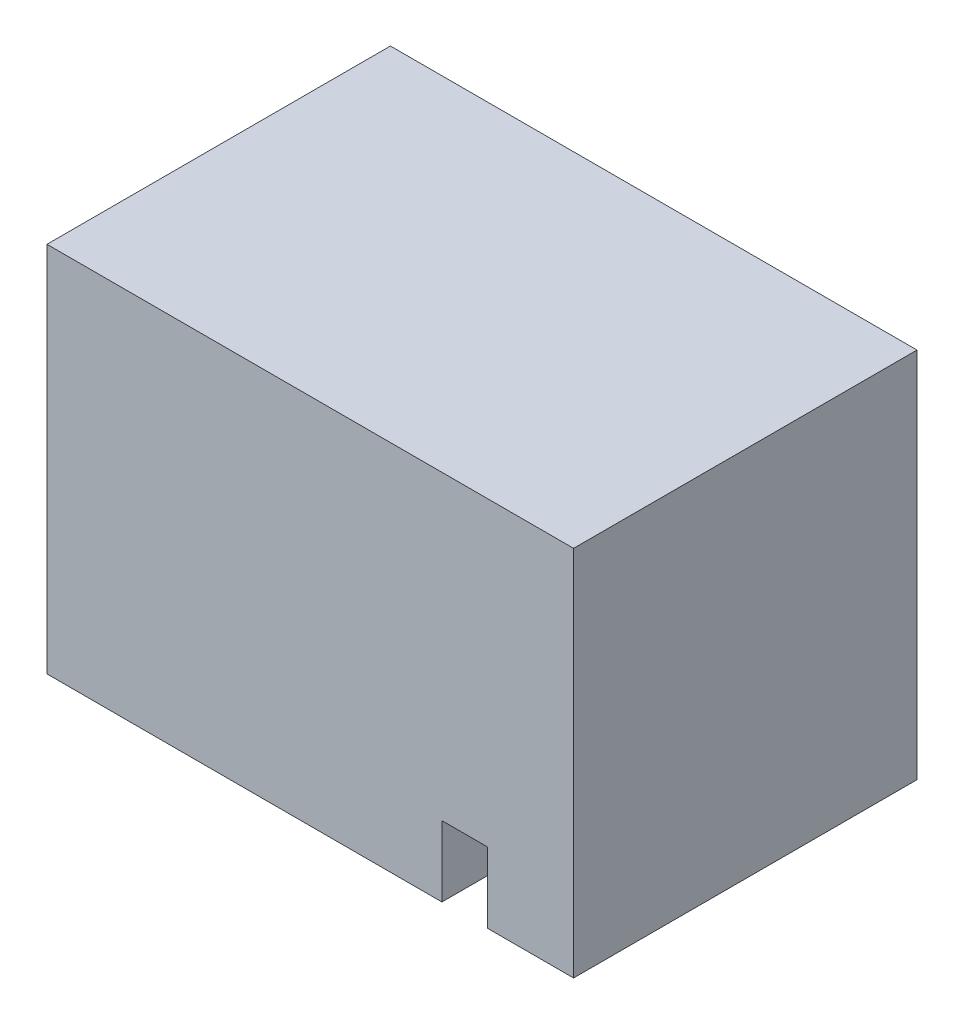
from build123d import *

# Parameters (mm, degrees)
BOSS_EXTRUDE1_DEPTH = 60
SKETCH1_6_W         = 8.001
SKETCH1_6_H         = 12.31
BOSS_EXTRUDE3_DEPTH = 26.01546
SKETCH2_W           = 2
SKETCH2_H           = 2
BOSS_EXTRUDE4_DEPTH = 12.31


with BuildPart() as part:
    # Sketch1 → Boss-Extrude1 (new body)
    with BuildSketch(Plane.XY):
        Polygon((77.001, 12.31), (77.001, 0), (92.001, 0), (92.001, 65.01), (0, 65.01), (0, 0), (69, 0), (69, 12.31), align=None)
    extrude(amount=BOSS_EXTRUDE1_DEPTH)

    # Sketch1<6> → Boss-Extrude3 (add)
    with BuildSketch(Plane.XY):
        with Locations((73.0005, 6.155)):
            Rectangle(SKETCH1_6_W, SKETCH1_6_H)
    extrude(amount=BOSS_EXTRUDE3_DEPTH)

    # Sketch2 → Boss-Extrude4 (add)
    with BuildSketch(Plane.XZ):
        with Locations((73.0005, 30.00046)):
            Rectangle(SKETCH2_W, SKETCH2_H)
    extrude(amount=-BOSS_EXTRUDE4_DEPTH)


solid = part.part
